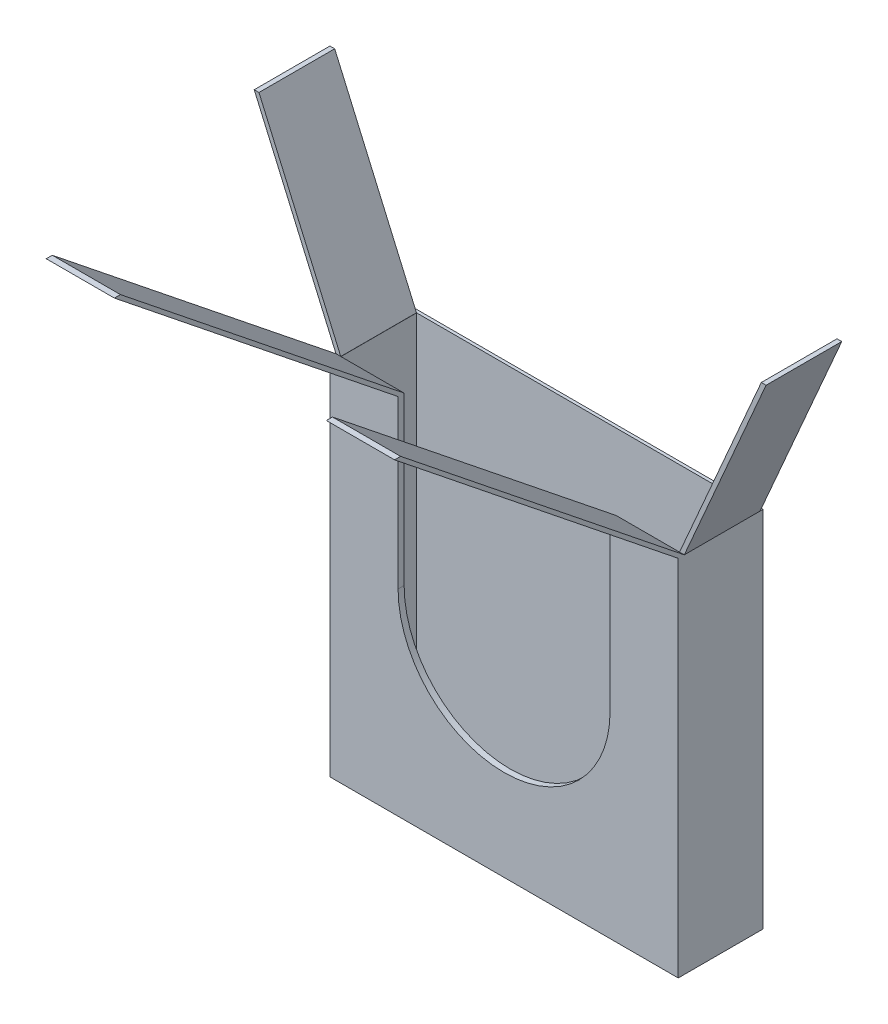
from build123d import *

# Parameters (mm, degrees)
BOSS_EXTRUDE1_DEPTH = 5.08
BOSS_EXTRUDE2_DEPTH = 57.15
BOSS_EXTRUDE3_DEPTH = 63.5
BOSS_EXTRUDE4_DEPTH = 63.5
BOSS_EXTRUDE5_DEPTH = 57.15
SKETCH7_W           = 292.1
SKETCH7_H           = 304.8
BOSS_EXTRUDE6_DEPTH = 2.54


with BuildPart() as part:
    # Sketch1 → Boss-Extrude1 (new body)
    with BuildSketch(Plane.XY):
        with BuildLine():
            Line((-88.9, 152.4), (-88.9, 12.7))
            ThreePointArc((-88.9, 12.7), (0, -76.2), (88.9, 12.7))
            Line((88.9, 12.7), (88.9, 152.4))
            Line((88.9, 152.4), (146.05, 152.4))
            Line((146.05, 152.4), (146.05, -152.4))
            Line((146.05, -152.4), (-146.05, -152.4))
            Line((-146.05, -152.4), (-146.05, 152.4))
            Line((-146.05, 152.4), (-88.9, 152.4))
        make_face()
    extrude(amount=BOSS_EXTRUDE1_DEPTH)

    # Sketch2 → Boss-Extrude2 (add)
    with BuildSketch(Plane(origin=(146.05, 0, 0), x_dir=(0, 0, -1), z_dir=(1, 0, 0))):
        Polygon((-5.08, 152.4), (-243.014423739, 342.9), (-237.934423739, 342.9), (0, 152.4), align=None)
    extrude(amount=-BOSS_EXTRUDE2_DEPTH)

    # Sketch3 → Boss-Extrude3 (add)
    with BuildSketch(Plane(origin=(0, 0, 0), x_dir=(-1, 0, 0), z_dir=(0, 0, -1))):
        Polygon((141.934676661, -147.172428926), (-142.059608363, -147.172428926), (-142.059608363, 152.4), (-146.05, 152.4), (-146.05, -152.4), (146.05, -152.4), (146.05, 152.4), (141.934676661, 152.4), align=None)
    extrude(amount=BOSS_EXTRUDE3_DEPTH)

    # Sketch4 → Boss-Extrude4 (add)
    with BuildSketch(Plane(origin=(0, 0, -63.5), x_dir=(-1, 0, 0), z_dir=(0, 0, -1))):
        Polygon((-146.05, 152.4), (-214.625070232, 309.862442089), (-210.634678595, 309.862442089), (-142.059608363, 152.4), align=None)
    boss_extrude4 = extrude(amount=-BOSS_EXTRUDE4_DEPTH)

    # Mirror3: Boss-Extrude4 across plane
    add(boss_extrude4.mirror(Plane(origin=(0, 0, 0), x_dir=(0, 0, 1), z_dir=(1, 0, 0))))

    # Sketch6 → Boss-Extrude5 (add)
    with BuildSketch(Plane(origin=(-88.9, 0, 0), x_dir=(0, 0, -1), z_dir=(1, 0, 0))):
        Polygon((-5.08, 152.4), (-243.014423739, 342.9), (-237.934423739, 342.9), (0, 152.4), align=None)
    extrude(amount=-BOSS_EXTRUDE5_DEPTH)

    # Sketch7 → Boss-Extrude6 (add)
    with BuildSketch(Plane(origin=(0, 0, -63.5), x_dir=(-1, 0, 0), z_dir=(0, 0, -1))):
        Rectangle(SKETCH7_W, SKETCH7_H)
    extrude(amount=BOSS_EXTRUDE6_DEPTH)


solid = part.part
